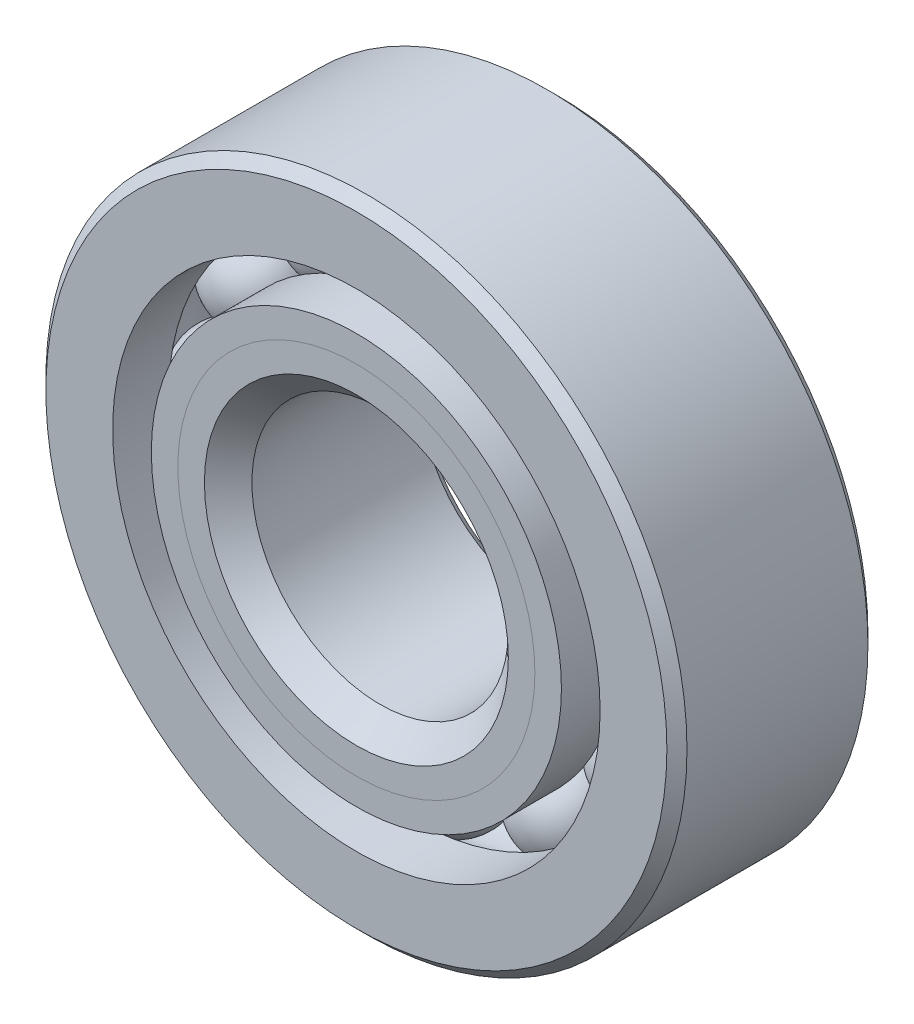
from build123d import *

# Parameters (mm, degrees)
CIRPATTERN1_COUNT = 12


with BuildPart() as part:
    # Sketch1 → Revolve1 (revolve)
    with BuildSketch(Plane(origin=(0, 0, 0), x_dir=(0, 0, -1), z_dir=(1, 0, 0))):
        with BuildLine():
            Line((2.24028, 7.9375), (-2.24028, 7.9375))
            Line((-2.24028, 7.9375), (-2.4892, 7.68858))
            Line((-2.4892, 7.68858), (-2.4892, 6.035221429))
            Line((-2.4892, 6.035221429), (-1.106311111, 6.035221429))
            ThreePointArc((-1.106311111, 6.035221429), (0, 6.76179465), (1.106311111, 6.035221429))
            Line((1.106311111, 6.035221429), (2.4892, 6.035221429))
            Line((2.4892, 6.035221429), (2.4892, 7.68858))
            Line((2.4892, 7.68858), (2.24028, 7.9375))
        make_face()
    revolve(axis=Axis((0, 0, 2.4892), (0, 0, -1)))


with BuildPart() as body_2:
    # Sketch2 → Revolve2 (revolve)
    with BuildSketch(Plane(origin=(0, 0, 0), x_dir=(0, 0, -1), z_dir=(1, 0, 0))):
        with BuildLine():
            Line((-2.4892, 5.077278571), (-1.106311111, 5.077278571))
            ThreePointArc((-1.106311111, 5.077278571), (-0.661784127, 4.548589505), (0, 4.35070535))
            Line((0, 4.35070535), (0, 3.762852675))
            Line((0, 3.762852675), (-1.831987052, 3.762852675))
            Line((-1.831987052, 3.762852675), (-2.4892, 4.420065623))
            Line((-2.4892, 4.420065623), (-2.4892, 5.077278571))
        make_face()
    revolve(axis=Axis((0, 0, 2.4892), (0, 0, -1)))


with BuildPart() as body_3:
    # Sketch3 → Revolve3 (revolve)
    with BuildSketch(Plane(origin=(0, 0, 0), x_dir=(0, 0, -1), z_dir=(1, 0, 0))):
        with BuildLine():
            Line((-2.4892, 4.420065623), (-1.831987052, 3.762852675))
            Line((-1.831987052, 3.762852675), (0, 3.762852675))
            Line((0, 3.762852675), (0, 4.35070535))
            ThreePointArc((0, 4.35070535), (0.661784127, 4.548589505), (1.106311111, 5.077278571))
            Line((1.106311111, 5.077278571), (2.4892, 5.077278571))
            Line((2.4892, 5.077278571), (2.4892, 3.42392))
            Line((2.4892, 3.42392), (2.24028, 3.175))
            Line((2.24028, 3.175), (-1.901347325, 3.175))
            Line((-1.901347325, 3.175), (-2.4892, 3.762852675))
            Line((-2.4892, 3.762852675), (-2.4892, 4.420065623))
        make_face()
    revolve(axis=Axis((0, 0, 2.4892), (0, 0, -1)))


with BuildPart() as body_4:
    # Sketch4 → Revolve4 (revolve)
    with BuildSketch(Plane(origin=(0, 0, 0), x_dir=(0, 0, -1), z_dir=(1, 0, 0))):
        with BuildLine():
            Line((-1.20554465, 5.55625), (1.20554465, 5.55625))
            ThreePointArc((1.20554465, 5.55625), (0, 6.76179465), (-1.20554465, 5.55625))
        make_face()
    revolve(axis=Axis((0, 5.55625, 1.20554465), (0, 0, -1)))


with BuildPart() as cirpattern1_1:
    # CirPattern1: pattern copy
    add(body_4.part.rotate(Axis((0, 0, -2.4892), (0, 0, 1)), 1 * 360 / CIRPATTERN1_COUNT))


with BuildPart() as cirpattern1_2:
    # CirPattern1: pattern copy
    add(body_4.part.rotate(Axis((0, 0, -2.4892), (0, 0, 1)), 2 * 360 / CIRPATTERN1_COUNT))


with BuildPart() as cirpattern1_3:
    # CirPattern1: pattern copy
    add(body_4.part.rotate(Axis((0, 0, -2.4892), (0, 0, 1)), 3 * 360 / CIRPATTERN1_COUNT))


with BuildPart() as cirpattern1_4:
    # CirPattern1: pattern copy
    add(body_4.part.rotate(Axis((0, 0, -2.4892), (0, 0, 1)), 4 * 360 / CIRPATTERN1_COUNT))


with BuildPart() as cirpattern1_5:
    # CirPattern1: pattern copy
    add(body_4.part.rotate(Axis((0, 0, -2.4892), (0, 0, 1)), 5 * 360 / CIRPATTERN1_COUNT))


with BuildPart() as cirpattern1_6:
    # CirPattern1: pattern copy
    add(body_4.part.rotate(Axis((0, 0, -2.4892), (0, 0, 1)), 6 * 360 / CIRPATTERN1_COUNT))


with BuildPart() as cirpattern1_7:
    # CirPattern1: pattern copy
    add(body_4.part.rotate(Axis((0, 0, -2.4892), (0, 0, 1)), 7 * 360 / CIRPATTERN1_COUNT))


with BuildPart() as cirpattern1_8:
    # CirPattern1: pattern copy
    add(body_4.part.rotate(Axis((0, 0, -2.4892), (0, 0, 1)), 8 * 360 / CIRPATTERN1_COUNT))


with BuildPart() as cirpattern1_9:
    # CirPattern1: pattern copy
    add(body_4.part.rotate(Axis((0, 0, -2.4892), (0, 0, 1)), 9 * 360 / CIRPATTERN1_COUNT))


with BuildPart() as cirpattern1_10:
    # CirPattern1: pattern copy
    add(body_4.part.rotate(Axis((0, 0, -2.4892), (0, 0, 1)), 10 * 360 / CIRPATTERN1_COUNT))


with BuildPart() as cirpattern1_11:
    # CirPattern1: pattern copy
    add(body_4.part.rotate(Axis((0, 0, -2.4892), (0, 0, 1)), 11 * 360 / CIRPATTERN1_COUNT))


solid = Compound([part.part, body_2.part, body_3.part, body_4.part, cirpattern1_1.part, cirpattern1_2.part, cirpattern1_3.part, cirpattern1_4.part, cirpattern1_5.part, cirpattern1_6.part, cirpattern1_7.part, cirpattern1_8.part, cirpattern1_9.part, cirpattern1_10.part, cirpattern1_11.part])
